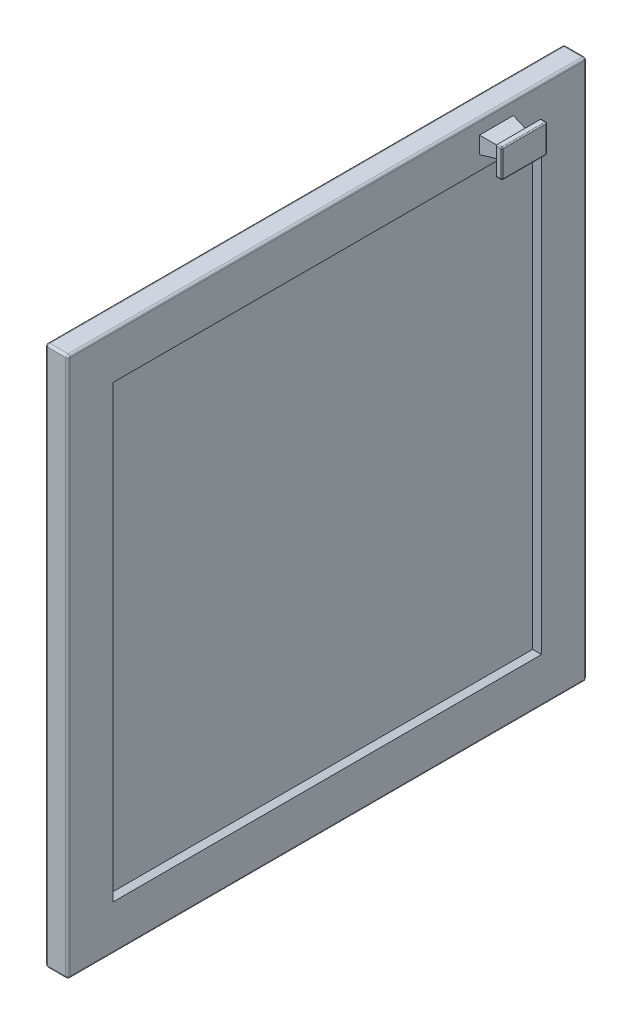
from build123d import *

# Parameters (mm, degrees)
SKETCH1_W               = 479
SKETCH1_H               = 460
BOSS_EXTRUDE1_DEPTH     = 10
SKETCH2_W               = 399
SKETCH2_H               = 380
CUT_EXTRUDE1_DEPTH      = 5
CUT_EXTRUDE1_DRAFT      = -30
MIRROR1_COPY_1_SKETCH_W = 399
MIRROR1_COPY_1_SKETCH_H = 380
MIRROR1_COPY_1_DEPTH    = 5
MIRROR1_COPY_1_DRAFT    = -30
SKETCH3_W               = 15
SKETCH3_H               = 30
BOSS_EXTRUDE2_DEPTH     = 20
BOSS_EXTRUDE2_TAPER     = 10
SKETCH4_W               = 25
SKETCH4_H               = 40
BOSS_EXTRUDE3_DEPTH     = 5
FILLET3_R               = 2
FILLET4_R               = 1


with BuildPart() as part:
    # Sketch1 → Boss-Extrude1 (new, symmetric)
    with BuildSketch(Plane.YZ):
        with Locations((239.5, 230)):
            Rectangle(SKETCH1_W, SKETCH1_H)
    extrude(amount=BOSS_EXTRUDE1_DEPTH, both=True)


with BuildPart() as cut_extrude1_tool:
    # Sketch2 → Cut-Extrude1 (with draft: the straight prism first)
    with BuildSketch(Plane.YZ.offset(10)):
        with Locations((239.5, 230)):
            Rectangle(SKETCH2_W, SKETCH2_H)
    extrude(amount=-CUT_EXTRUDE1_DEPTH)
    # Cut-Extrude1: the draft: its side faces are tilted about the plane it starts from
    cut_extrude1_sides = [cut_extrude1_tool.faces().sort_by_distance(p)[0] for p in [
        (7.5, 40, 230),
        (7.5, 239.5, 40),
        (7.5, 439, 230),
        (7.5, 239.5, 420),
    ]]
    draft(cut_extrude1_sides, Plane.YZ.offset(10), CUT_EXTRUDE1_DRAFT)


with BuildPart() as part_1:
    add(part.part)

    # Cut-Extrude1: cut by cut_extrude1_tool
    add(cut_extrude1_tool.part, mode=Mode.SUBTRACT)


with BuildPart() as mirror1_copy_1_tool:
    # Mirror1 copy 1 sketch → Mirror1 copy 1 (with draft: the straight prism first)
    with BuildSketch(Plane(origin=(-10, 0, 0), x_dir=(0, 1, 0), z_dir=(-1, 0, 0))):
        with Locations((239.5, -230)):
            Rectangle(MIRROR1_COPY_1_SKETCH_W, MIRROR1_COPY_1_SKETCH_H)
    extrude(amount=-MIRROR1_COPY_1_DEPTH)
    # Mirror1 copy 1: the draft: its side faces are tilted about the plane it starts from
    mirror1_copy_1_sides = [mirror1_copy_1_tool.faces().sort_by_distance(p)[0] for p in [
        (-7.5, 40, 230),
        (-7.5, 239.5, 40),
        (-7.5, 439, 230),
        (-7.5, 239.5, 420),
    ]]
    draft(mirror1_copy_1_sides, Plane(origin=(-10, 0, 0), x_dir=(0, 1, 0), z_dir=(-1, 0, 0)), MIRROR1_COPY_1_DRAFT)


with BuildPart() as part_2:
    add(part_1.part)

    # Mirror1 copy 1: cut by mirror1_copy_1_tool
    add(mirror1_copy_1_tool.part, mode=Mode.SUBTRACT)

    # Sketch3 → Boss-Extrude2 (add)
    with BuildSketch(Plane.YZ.offset(10)):
        with Locations((459, 80)):
            Rectangle(SKETCH3_W, SKETCH3_H)
    extrude(amount=BOSS_EXTRUDE2_DEPTH, taper=BOSS_EXTRUDE2_TAPER)

    # Sketch4 → Boss-Extrude3 (add)
    with BuildSketch(Plane.YZ.offset(30)):
        with Locations((459, 80)):
            Rectangle(SKETCH4_W, SKETCH4_H)
    extrude(amount=BOSS_EXTRUDE3_DEPTH)

    # Fillet3
    fillet3_edges = [part_2.edges().sort_by_distance(p)[0] for p in [
        (10, 479, 230),
        (10, 239.5, 460),
        (10, 0, 230),
        (-10, 239.5, 460),
        (-10, 479, 230),
        (-10, 239.5, 0),
        (-10, 0, 230),
        (0, 0, 460),
        (0, 479, 460),
        (0, 479, 0),
        (0, 0, 0),
        (10, 239.5, 0),
    ]]
    fillet(fillet3_edges, radius=FILLET3_R)

    # Fillet4
    fillet4_edges = [part_2.edges().sort_by_distance(p)[0] for p in [
        (32.5, 446.5, 100),
        (32.5, 446.5, 60),
        (32.5, 471.5, 60),
        (32.5, 471.5, 100),
        (35, 446.5, 80),
        (35, 459, 60),
        (35, 471.5, 80),
        (35, 459, 100),
    ]]
    fillet(fillet4_edges, radius=FILLET4_R)


solid = part_2.part
